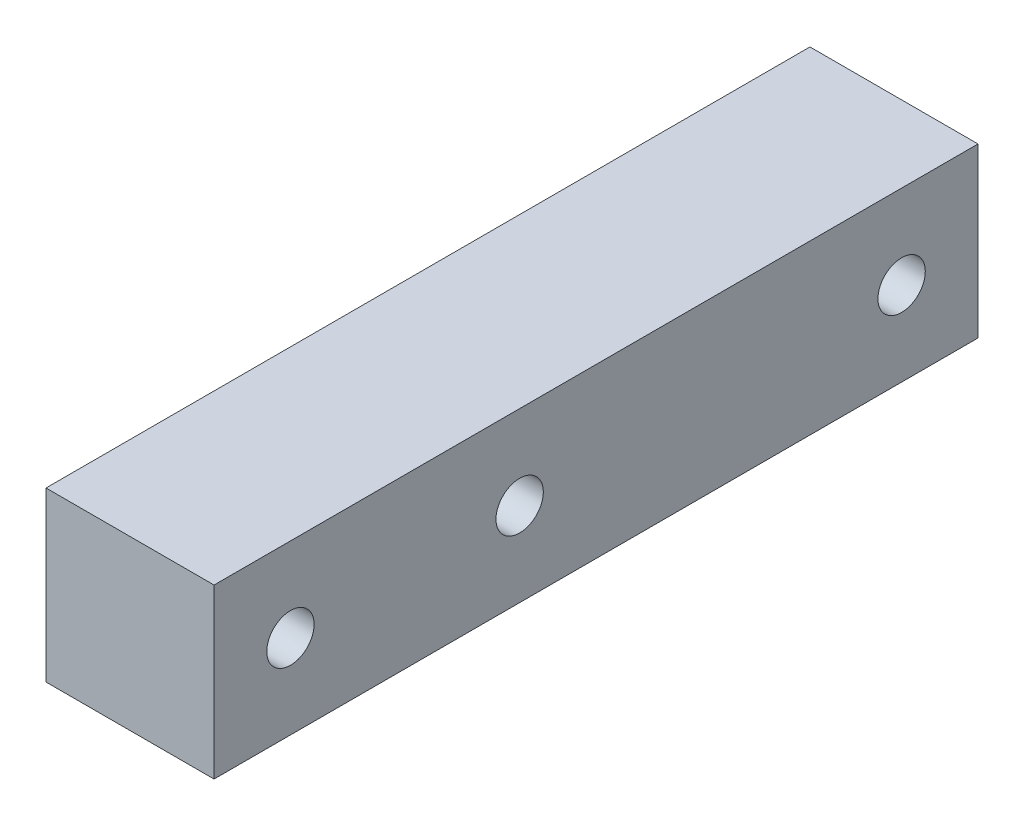
from build123d import *

# Parameters (mm, degrees)
SKETCH1_W           = 63.5
SKETCH1_H           = 13.97
BOSS_EXTRUDE3_DEPTH = 13.97
SKETCH3_R           = 1.9685
CUT_EXTRUDE1_DEPTH  = 254
CUT_EXTRUDE3_DEPTH  = 254


with BuildPart() as part:
    # Sketch1 → Boss-Extrude3 (new body)
    with BuildSketch(Plane(origin=(0, 0, 0), x_dir=(0, 0, -1), z_dir=(1, 0, 0))):
        with Locations((31.75, 6.985)):
            Rectangle(SKETCH1_W, SKETCH1_H)
    extrude(amount=BOSS_EXTRUDE3_DEPTH)

    # Sketch3 → Cut-Extrude1 (cut)
    with BuildSketch(Plane(origin=(13.97, 0, 0), x_dir=(0, 0, -1), z_dir=(1, 0, 0))):
        with Locations((6.35, 6.985)):
            Circle(SKETCH3_R)
        with Locations((57.15, 6.985)):
            Circle(SKETCH3_R)
    extrude(amount=-CUT_EXTRUDE1_DEPTH, mode=Mode.SUBTRACT)

    # Sketch4 → Cut-Extrude3 (cut)
    with BuildSketch(Plane(origin=(13.97, 0, 0), x_dir=(0, 0, -1), z_dir=(1, 0, 0))):
        with BuildLine():
            ThreePointArc((23.4315, 6.985), (25.4, 5.0165), (27.3685, 6.985))
            ThreePointArc((27.3685, 6.985), (25.4, 8.9535), (23.4315, 6.985))
        make_face()
    extrude(amount=-CUT_EXTRUDE3_DEPTH, mode=Mode.SUBTRACT)


solid = part.part
